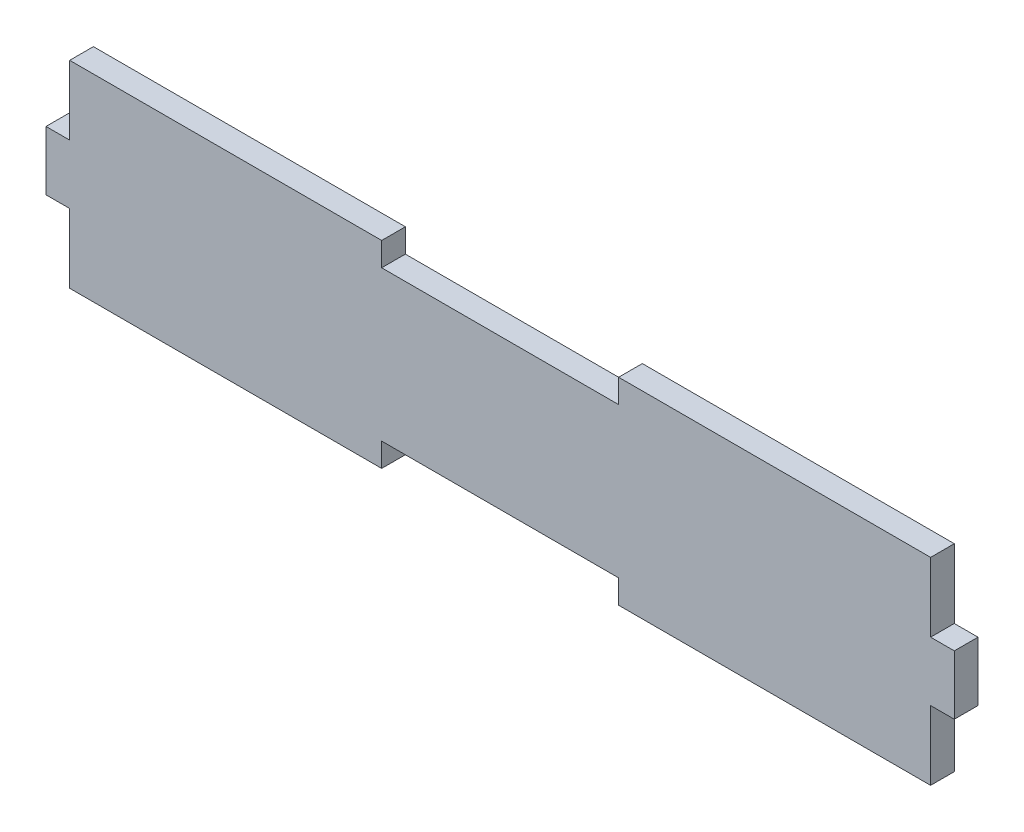
from build123d import *

# Parameters (mm, degrees)
SALIENTE_EXTRUIR1_DEPTH = 6


with BuildPart() as part:
    # Croquis1 → Saliente-Extruir1 (new body)
    with BuildSketch(Plane.XY):
        Polygon((-30, 19), (-30, 25), (-109, 25), (-109, 7.5), (-115, 7.5), (-115, -7.5), (-109, -7.5), (-109, -25), (-30, -25), (-30, -19), (30, -19), (30, -25), (109, -25), (109, -7.5), (115, -7.5), (115, 7.5), (109, 7.5), (109, 25), (30, 25), (30, 19), align=None)
    extrude(amount=SALIENTE_EXTRUIR1_DEPTH)


solid = part.part
